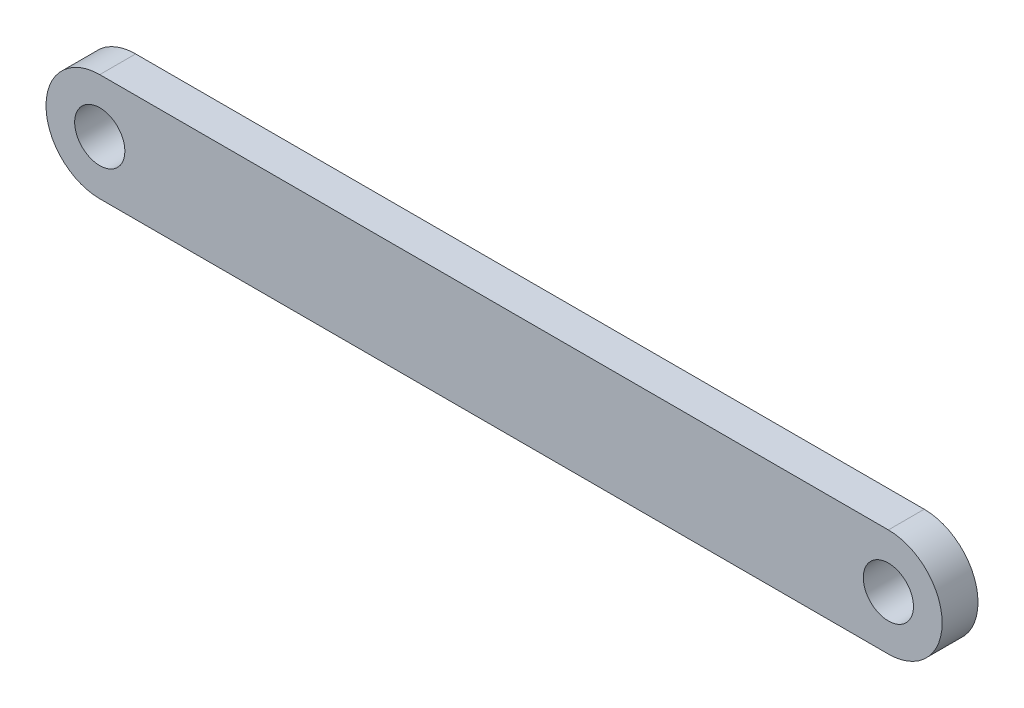
from build123d import *

# Parameters (mm, degrees)
BOSS_EXTRUDE1_DEPTH = 2.54
SKETCH2_R           = 1.778
CUT_EXTRUDE1_DEPTH  = 2.54


with BuildPart() as part:
    # Sketch1 → Boss-Extrude1 (new body)
    with BuildSketch(Plane.XY):
        with BuildLine():
            Line((-27.94, 0), (27.94, 0))
            ThreePointArc((27.94, 0), (31.75, -3.81), (27.94, -7.62))
            Line((27.94, -7.62), (-27.94, -7.62))
            ThreePointArc((-27.94, -7.62), (-31.75, -3.81), (-27.94, 0))
        make_face()
    extrude(amount=BOSS_EXTRUDE1_DEPTH)

    # Sketch2 → Cut-Extrude1 (cut)
    with BuildSketch(Plane.XY.offset(2.54)):
        with Locations((-27.94, -3.81)):
            Circle(SKETCH2_R)
    cut_extrude1 = extrude(amount=-CUT_EXTRUDE1_DEPTH, mode=Mode.SUBTRACT)

    # Mirror1: Cut-Extrude1 across plane
    add(cut_extrude1.mirror(Plane(origin=(0, 0, 0), x_dir=(0, 0, 1), z_dir=(1, 0, 0))), mode=Mode.SUBTRACT)


solid = part.part
